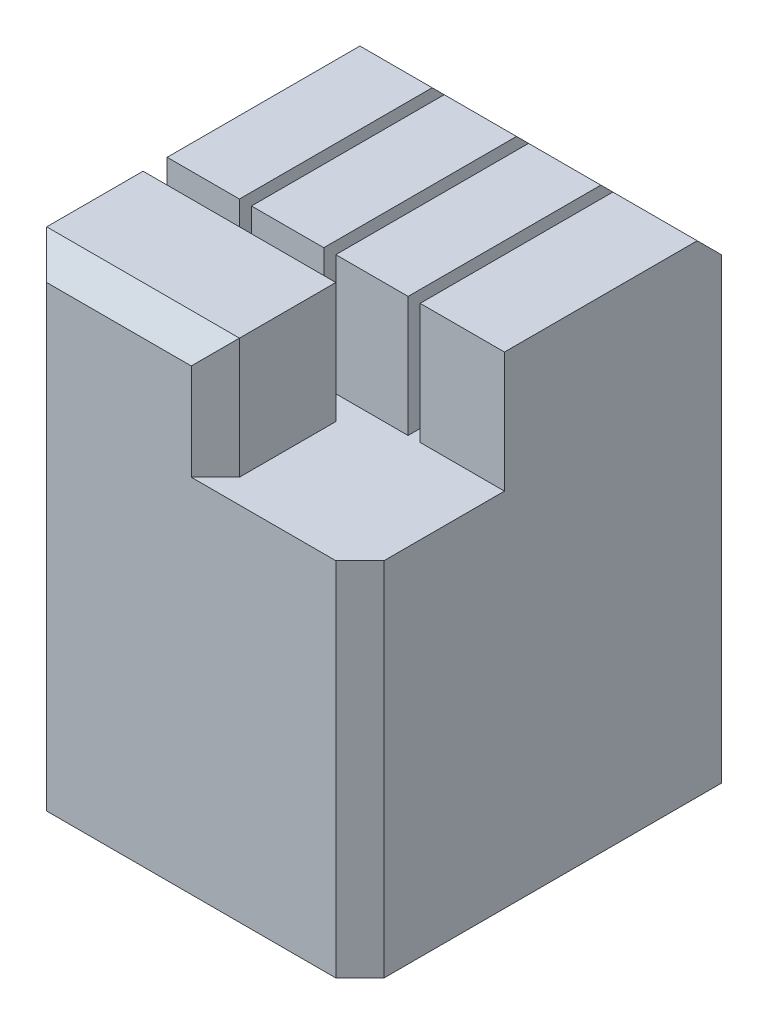
from build123d import *

# Parameters (mm, degrees)
SKETCH1_W           = 14
SKETCH1_H           = 16
BOSS_EXTRUDE1_DEPTH = 20
CUT_EXTRUDE1_DEPTH  = 5
CHAMFER1_SIZE       = 2
CHAMFER2_SIZE       = 1
SKETCH4_R           = 5
CUT_EXTRUDE2_DEPTH  = 12


with BuildPart() as part:
    # Sketch1 → Boss-Extrude1 (new body)
    with BuildSketch(Plane(origin=(0, 0, 0), x_dir=(1, 0, 0), z_dir=(0, 1, 0))):
        with Locations((7, 8)):
            Rectangle(SKETCH1_W, SKETCH1_H)
    extrude(amount=-BOSS_EXTRUDE1_DEPTH)

    # Sketch2 → Cut-Extrude1 (cut)
    with BuildSketch(Plane(origin=(0, 0, 0), x_dir=(1, 0, 0), z_dir=(0, 1, 0))):
        Polygon((3, 6), (0, 6), (0, 5), (8, 5), (8, 0), (14, 0), (14, 6), (10.5, 6), (10.5, 16), (10, 16), (10, 6), (7, 6), (7, 16), (6.5, 16), (6.5, 6), (3.5, 6), (3.5, 16), (3, 16), align=None)
    extrude(amount=-CUT_EXTRUDE1_DEPTH, mode=Mode.SUBTRACT)

    # Chamfer1
    chamfer1_edges = [part.edges().sort_by_distance(p)[0] for p in [
        (8.5, 0, -16),
        (5, 0, -16),
        (1.5, 0, -16),
        (12.25, 0, -16),
    ]]
    chamfer(chamfer1_edges, length=CHAMFER1_SIZE)

    # Chamfer2
    chamfer2_edges = [part.edges().sort_by_distance(p)[0] for p in [
        (8, -2.5, 0),
        (4, 0, 0),
        (0, -11, -16),
        (14, -11, -16),
        (14, -12.5, 0),
        (0, -10, 0),
    ]]
    chamfer(chamfer2_edges, length=CHAMFER2_SIZE)

    # Sketch4 → Cut-Extrude2 (cut)
    with BuildSketch(Plane.XZ.offset(20)):
        with Locations(Location((7, -8, 0), (0, 0, 270))):
            Circle(SKETCH4_R)
    extrude(amount=-CUT_EXTRUDE2_DEPTH, mode=Mode.SUBTRACT)


solid = part.part
